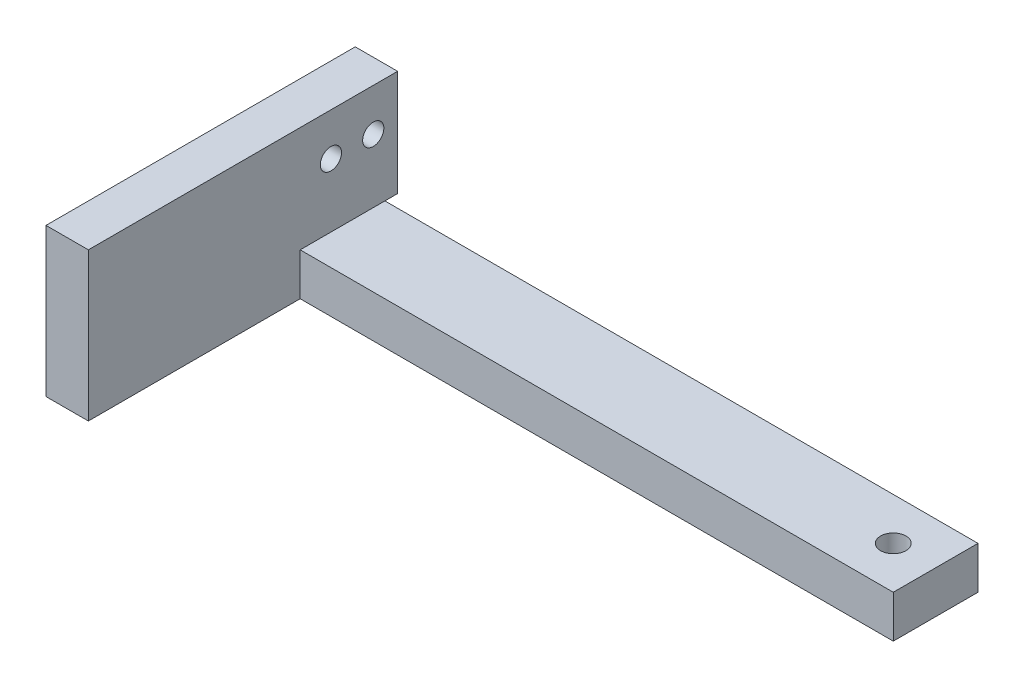
from build123d import *

# Parameters (mm, degrees)
SKETCH1_W           = 150
SKETCH1_H           = 20
BOSS_EXTRUDE1_DEPTH = 10
SKETCH2_R           = 3
CUT_EXTRUDE1_DEPTH  = 10
SKETCH3_W           = 23
SKETCH3_H           = 25
BOSS_EXTRUDE2_DEPTH = 10
SKETCH4_R           = 2.5
CUT_EXTRUDE2_DEPTH  = 480.576193501
SKETCH5_W           = 10
SKETCH5_H           = 35
BOSS_EXTRUDE3_DEPTH = 50


with BuildPart() as part:
    # Sketch1 → Boss-Extrude1 (new body)
    with BuildSketch(Plane(origin=(0, 0, 0), x_dir=(1, 0, 0), z_dir=(0, 1, 0))):
        with Locations((-2472.770700637, 441.167728238)):
            Rectangle(SKETCH1_W, SKETCH1_H)
    extrude(amount=BOSS_EXTRUDE1_DEPTH)

    # Sketch2 → Cut-Extrude1 (cut)
    with BuildSketch(Plane(origin=(0, 10, 0), x_dir=(1, 0, 0), z_dir=(0, 1, 0))):
        with Locations(Location((-2407.770700637, 441.167728238, 0), (0, 0, 270))):
            Circle(SKETCH2_R)
    extrude(amount=-CUT_EXTRUDE1_DEPTH, mode=Mode.SUBTRACT)

    # Sketch3 → Boss-Extrude2 (add)
    with BuildSketch(Plane.ZY.offset(2547.770700637)):
        with Locations((-442.667728238, 22.5)):
            Rectangle(SKETCH3_W, SKETCH3_H)
    extrude(amount=-BOSS_EXTRUDE2_DEPTH)

    # Sketch4 → Cut-Extrude2 (cut, through all)
    with BuildSketch(Plane.ZY.offset(2547.770700637)):
        with Locations((-448.417728238, 25)):
            Circle(SKETCH4_R)
        with Locations((-438.417728238, 25)):
            Circle(SKETCH4_R)
    extrude(amount=-CUT_EXTRUDE2_DEPTH, mode=Mode.SUBTRACT)

    # Sketch5 → Boss-Extrude3 (add)
    with BuildSketch(Plane.XY.offset(-431.167728238)):
        with Locations((-2542.770700637, 17.5)):
            Rectangle(SKETCH5_W, SKETCH5_H)
    extrude(amount=BOSS_EXTRUDE3_DEPTH)


solid = part.part
